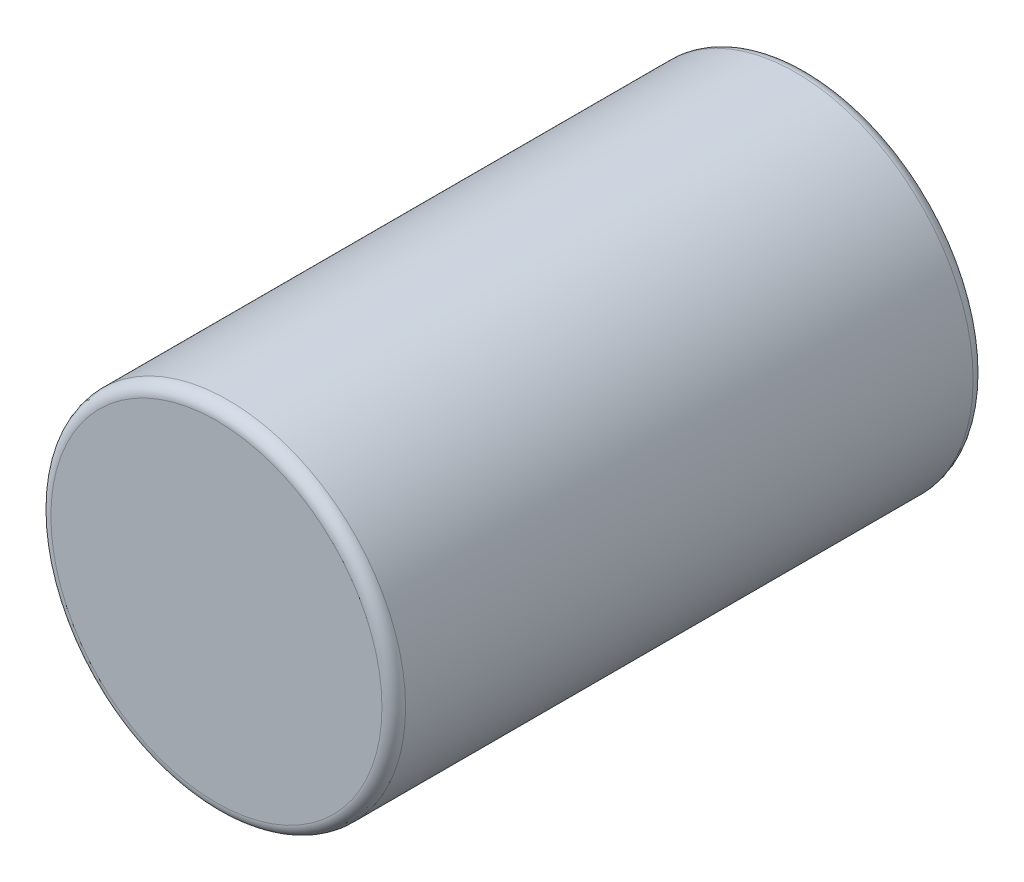
from build123d import *

# Parameters (mm, degrees)
SKETCH_1_R      = 3
EXTRUDE_1_DEPTH = 10
FILLET_1_R      = 0.2


with BuildPart() as part:
    # 스케치1 → 보스-돌출1 (new body)
    with BuildSketch(Plane.XY):
        Circle(SKETCH_1_R)
    extrude(amount=EXTRUDE_1_DEPTH)

    # 필렛1
    fillet_1_edges = [part.edges().sort_by_distance(p)[0] for p in [
        (-3, 0, 0),
        (-3, 0, 10),
    ]]
    fillet(fillet_1_edges, radius=FILLET_1_R)


solid = part.part
